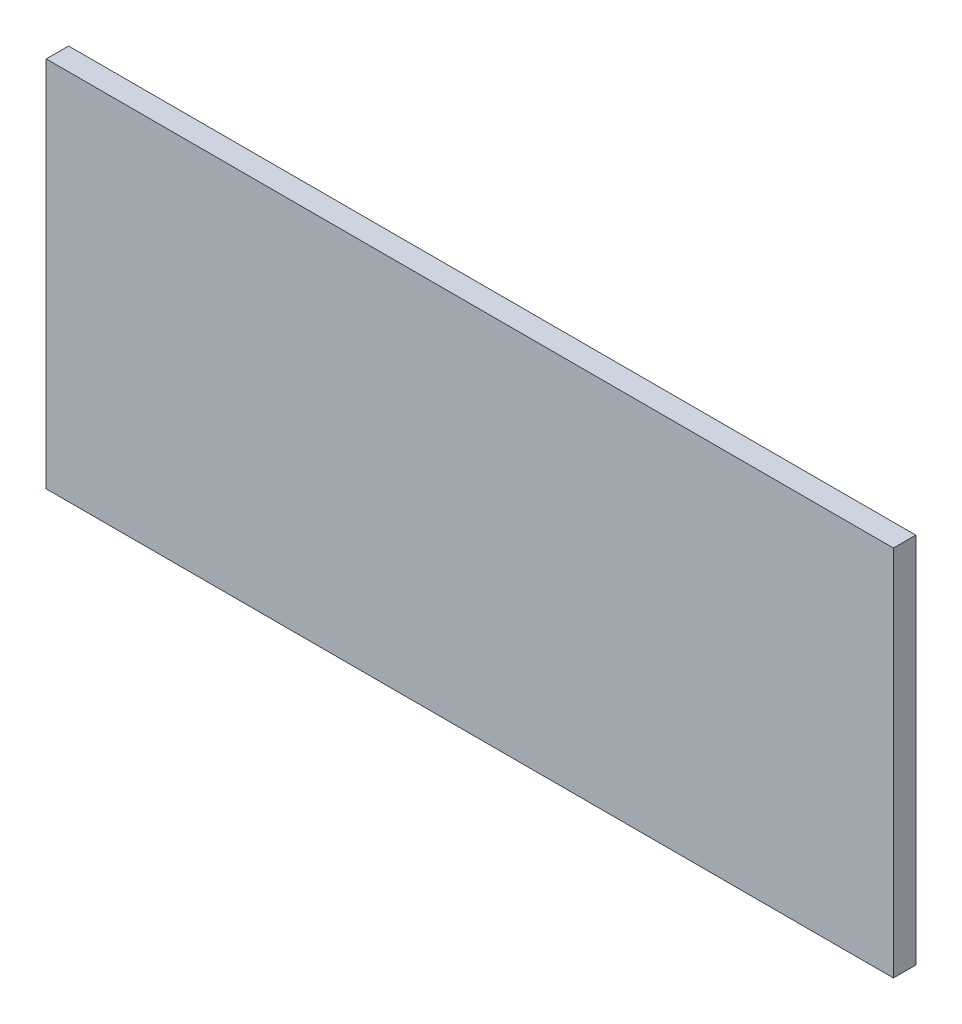
from build123d import *

# Parameters (mm, degrees)
SKETCH_1_W      = 455
SKETCH_1_H      = 200
EXTRUDE_1_DEPTH = 12


with BuildPart() as part:
    # 草图1 → 拉伸1 (new body)
    with BuildSketch(Plane.XY):
        with Locations((227.5, 100)):
            Rectangle(SKETCH_1_W, SKETCH_1_H)
    extrude(amount=EXTRUDE_1_DEPTH)


solid = part.part
